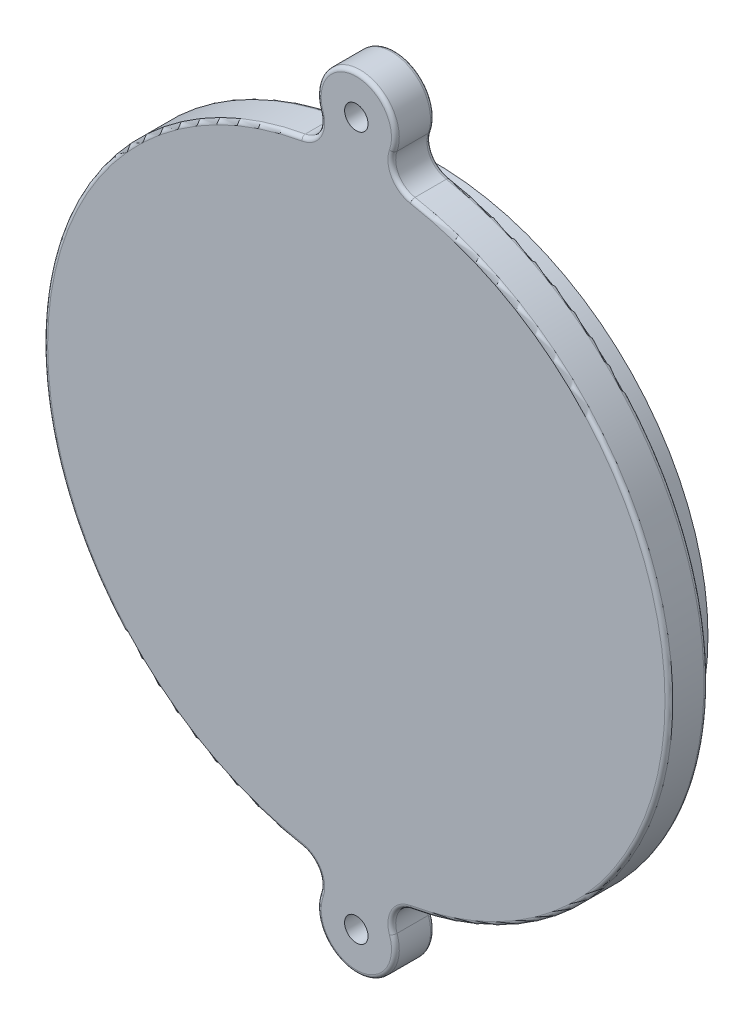
from build123d import *

# Parameters (mm, degrees)
ESQUISSE1_R        = 1.5
BOSS_EXTRU_1_DEPTH = 5
ESQUISSE2_R        = 35
ESQUISSE2_R_2      = 30.015
BOSS_EXTRU_2_DEPTH = 5
CONG_1_R           = 0.5
CONG_2_R           = 1


with BuildPart() as part:
    # Esquisse1 → Boss.-Extru.1 (new body)
    with BuildSketch(Plane.XY):
        with BuildLine():
            ThreePointArc((-7.016253333, 39.379844961), (-40, 0), (-7.016253333, -39.379844961))
            ThreePointArc((-7.016253333, -39.379844961), (-4.949996637, -40.823674508), (-4.714045208, -43.333333333))
            ThreePointArc((-4.714045208, -43.333333333), (0, -50), (4.714045208, -43.333333333))
            ThreePointArc((4.714045208, -43.333333333), (4.949996637, -40.823674508), (7.016253333, -39.379844961))
            ThreePointArc((7.016253333, -39.379844961), (40, 0), (7.016253333, 39.379844961))
            ThreePointArc((7.016253333, 39.379844961), (4.949996637, 40.823674508), (4.714045208, 43.333333333))
            ThreePointArc((4.714045208, 43.333333333), (0, 50), (-4.714045208, 43.333333333))
            ThreePointArc((-4.714045208, 43.333333333), (-4.949996637, 40.823674508), (-7.016253333, 39.379844961))
        make_face()
        with Locations((0, 45)):
            Circle(ESQUISSE1_R, mode=Mode.SUBTRACT)
        with Locations(Location((0, -45, 0), (0, 0, 180))):
            Circle(ESQUISSE1_R, mode=Mode.SUBTRACT)
    extrude(amount=BOSS_EXTRU_1_DEPTH)

    # Esquisse2 → Boss.-Extru.2 (add)
    with BuildSketch(Plane(origin=(0, 0, 0), x_dir=(-1, 0, 0), z_dir=(0, 0, -1))):
        with Locations(Location((0, 0, 0), (0, 0, 180))):
            Circle(ESQUISSE2_R)
        Circle(ESQUISSE2_R_2, mode=Mode.SUBTRACT)
    extrude(amount=BOSS_EXTRU_2_DEPTH)

    # Congé1
    cong_1_edges = [part.edges().sort_by_distance(p)[0] for p in [
        (0, -50, 0),
        (-4.949996637, -40.823674508, 0),
        (-40, 0, 0),
        (-4.949996637, 40.823674508, 0),
        (-4.949996637, -40.823674508, 5),
        (0, -50, 5),
        (4.949996637, -40.823674508, 5),
        (40, 0, 5),
        (4.949996637, 40.823674508, 5),
        (0, 50, 5),
        (-4.949996637, 40.823674508, 5),
        (0, 50, 0),
        (-40, 0, 5),
        (4.949996637, 40.823674508, 0),
        (40, 0, 0),
        (4.949996637, -40.823674508, 0),
    ]]
    fillet(cong_1_edges, radius=CONG_1_R)

    # Congé2
    cong_2_edges = [part.edges().sort_by_distance(p)[0] for p in [
        (-35, 0, 0),
    ]]
    fillet(cong_2_edges, radius=CONG_2_R)


solid = part.part
